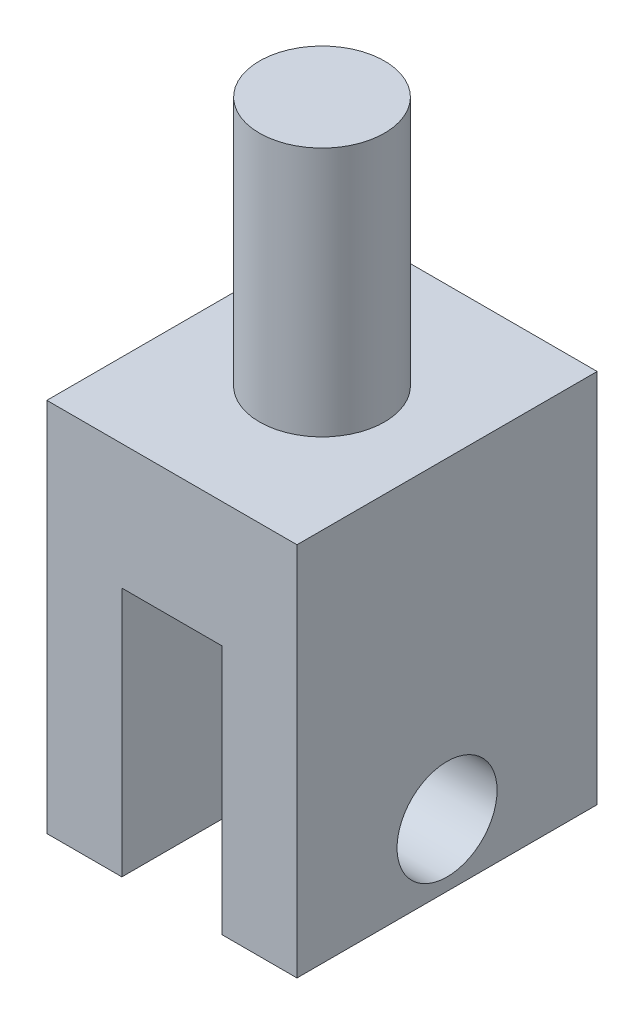
from build123d import *

# Parameters (mm, degrees)
SKETCH1_W             = 30
SKETCH1_H             = 120
BOSS_EXTRUDE1_DEPTH   = 100
BOSS_EXTRUDE1_2_DEPTH = 100
SKETCH2_R             = 20
CUT_EXTRUDE1_DEPTH    = 150
SKETCH3_W             = 100
SKETCH3_H             = 120
BOSS_EXTRUDE2_DEPTH   = 50
SKETCH4_R             = 25
BOSS_EXTRUDE3_DEPTH   = 100


with BuildPart() as part:
    # Sketch1 → Boss-Extrude1 (new body)
    with BuildSketch(Plane(origin=(0, 0, 0), x_dir=(1, 0, 0), z_dir=(0, 1, 0))):
        with Locations((-35, 0)):
            Rectangle(SKETCH1_W, SKETCH1_H)
    extrude(amount=BOSS_EXTRUDE1_DEPTH)


with BuildPart() as body_2:
    # Sketch1 → Boss-Extrude1 2 (new body)
    with BuildSketch(Plane(origin=(0, 0, 0), x_dir=(1, 0, 0), z_dir=(0, 1, 0))):
        with Locations((35, 0)):
            Rectangle(SKETCH1_W, SKETCH1_H)
    extrude(amount=BOSS_EXTRUDE1_2_DEPTH)


with BuildPart() as cut_extrude1_tool:
    # Sketch2 → Cut-Extrude1 (new body)
    with BuildSketch(Plane(origin=(50, 0, 0), x_dir=(0, 0, -1), z_dir=(1, 0, 0))):
        with Locations((0, 25)):
            Circle(SKETCH2_R)
    extrude(amount=-CUT_EXTRUDE1_DEPTH)


with BuildPart() as part_1:
    add(part.part)

    # Cut-Extrude1: cut by cut_extrude1_tool
    add(cut_extrude1_tool.part, mode=Mode.SUBTRACT)



with BuildPart() as body_2_1:
    add(body_2.part)

    # Cut-Extrude1: cut by cut_extrude1_tool
    add(cut_extrude1_tool.part, mode=Mode.SUBTRACT)


with BuildPart() as part_2:
    add(part_1.part)

    add(body_2_1.part)  # Boss-Extrude2 merges body 2
    # Sketch3 → Boss-Extrude2 (add)
    with BuildSketch(Plane(origin=(0, 100, 0), x_dir=(1, 0, 0), z_dir=(0, 1, 0))):
        Rectangle(SKETCH3_W, SKETCH3_H)
    extrude(amount=BOSS_EXTRUDE2_DEPTH)

    # Sketch4 → Boss-Extrude3 (add)
    with BuildSketch(Plane(origin=(0, 150, 0), x_dir=(1, 0, 0), z_dir=(0, 1, 0))):
        with Locations(Location((0, 0, 0), (0, 0, 270))):
            Circle(SKETCH4_R)
    extrude(amount=BOSS_EXTRUDE3_DEPTH)


solid = part_2.part
